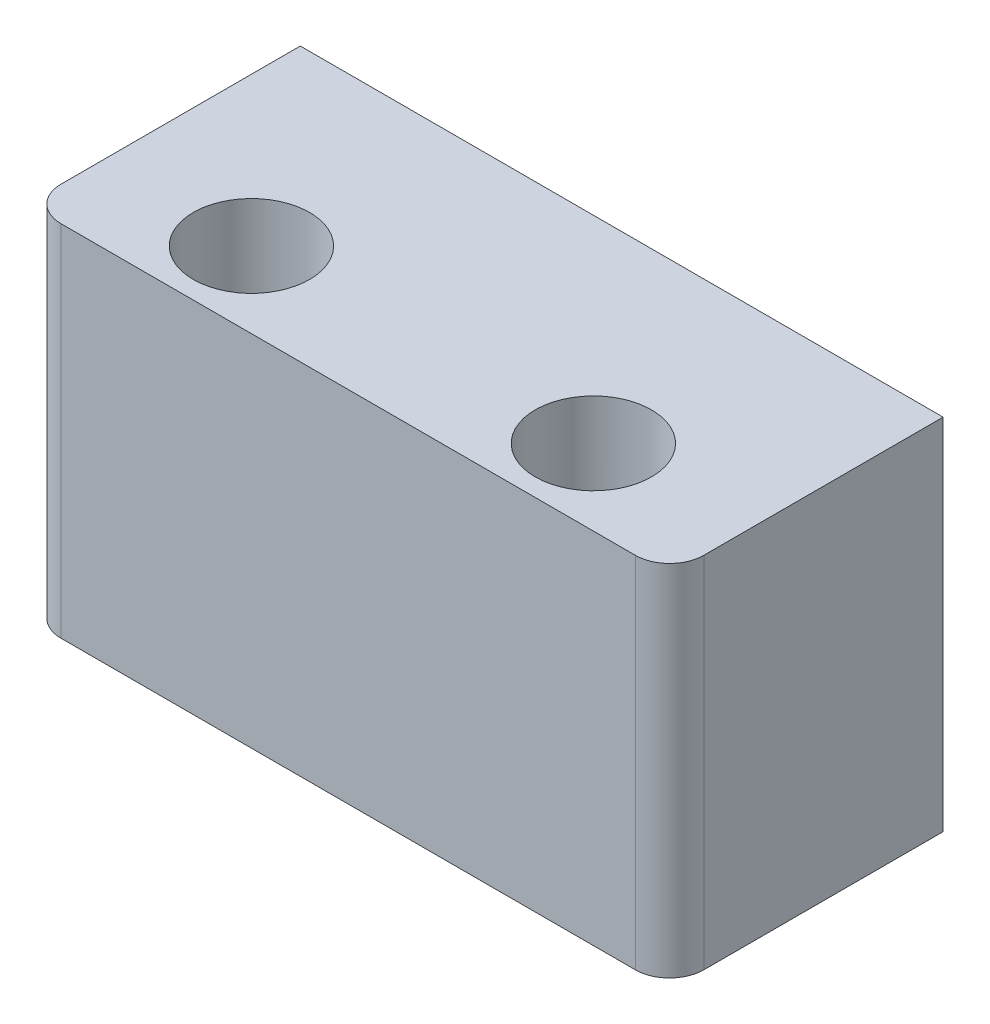
from build123d import *

# Parameters (mm, degrees)
SKETCH_1_W        = 18.8
SKETCH_1_H        = 8
EXTRUDE_1_DEPTH   = 10.5
FILLET_1_R        = 1
HOLE_WIZARD_M31_D = 3.4


with BuildPart() as part:
    # Эскиз1 → Бобышка-Вытянуть1 (new body)
    with BuildSketch(Plane(origin=(0, 0, 0), x_dir=(1, 0, 0), z_dir=(0, 1, 0))):
        with Locations((9.4, -4)):
            Rectangle(SKETCH_1_W, SKETCH_1_H)
    extrude(amount=EXTRUDE_1_DEPTH)

    # Скругление1
    fillet_1_edges = [part.edges().sort_by_distance(p)[0] for p in [
        (18.8, 5.25, 8),
        (0, 5.25, 8),
    ]]
    fillet(fillet_1_edges, radius=FILLET_1_R)

    # Отверстие с зазором M31 (through all)
    with Locations(Plane(origin=(0, 10.5, 0), x_dir=(1, 0, 0), z_dir=(0, 1, 0))):
        with Locations((4.350247301, -5.779226371), (14.350247301, -5.779226371)):
            Hole(HOLE_WIZARD_M31_D / 2)


solid = part.part
